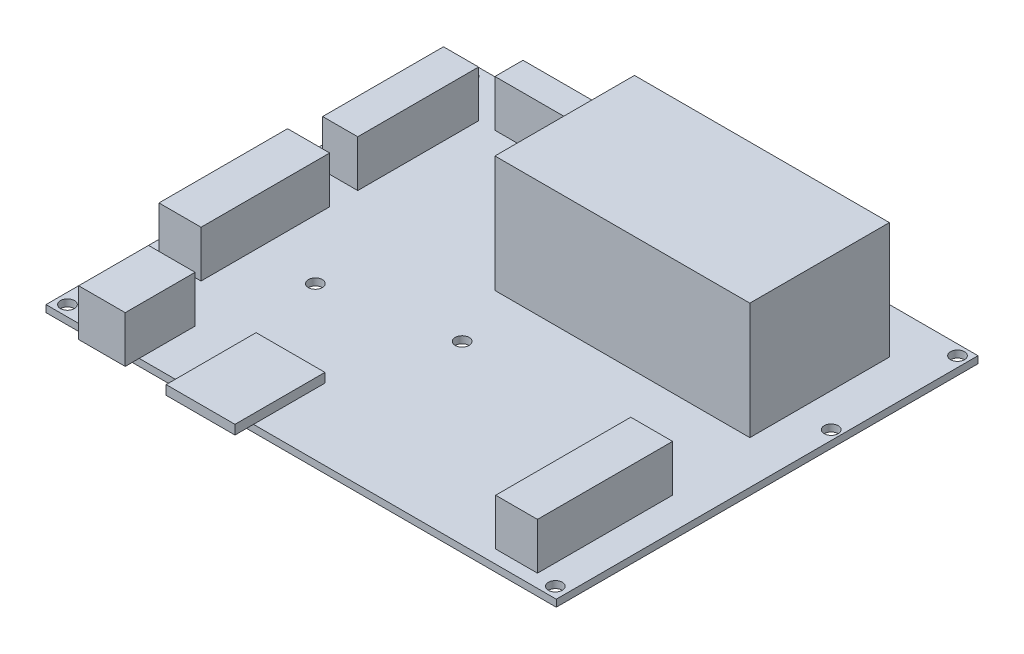
from build123d import *

# Parameters (mm, degrees)
SKETCH1_W           = 109.5
SKETCH1_H           = 90.5
SKETCH1_R           = 1.5
BOSS_EXTRUDE1_DEPTH = 1.5
SKETCH2_W           = 10
SKETCH2_H           = 15
BOSS_EXTRUDE2_DEPTH = 10
SKETCH3_W           = 14.7696301
SKETCH3_H           = 19.309368961
BOSS_EXTRUDE3_DEPTH = 2
SKETCH4_W           = 54.699442022
SKETCH4_H           = 29.942508018
BOSS_EXTRUDE4_DEPTH = 25
SKETCH5_W           = 9.03293538
SKETCH5_H           = 27.600635882
SKETCH5_W_2         = 7.52744615
SKETCH5_H_2         = 25.927870071
SKETCH5_W_3         = 22.080508706
SKETCH5_H_3         = 6.02195692
SKETCH5_W_4         = 8.97656987
SKETCH5_H_4         = 28.994339973
BOSS_EXTRUDE5_DEPTH = 10


with BuildPart() as part:
    # Sketch1 → Boss-Extrude1 (new body)
    with BuildSketch(Plane(origin=(0, 0, 0), x_dir=(1, 0, 0), z_dir=(0, 1, 0))):
        Rectangle(SKETCH1_W, SKETCH1_H)
        with Locations(Location((-52.45, -42.95, 0), (0, 0, 270))):
            Circle(SKETCH1_R, mode=Mode.SUBTRACT)
        with Locations(Location((-29.75, -12.45, 0), (0, 0, 270))):
            Circle(SKETCH1_R, mode=Mode.SUBTRACT)
        with Locations(Location((52.25, -42.95, 0), (0, 0, 270))):
            Circle(SKETCH1_R, mode=Mode.SUBTRACT)
        with Locations(Location((52.55, 43.05, 0), (0, 0, 270))):
            Circle(SKETCH1_R, mode=Mode.SUBTRACT)
        with Locations(Location((-51.75, 42.55, 0), (0, 0, 270))):
            Circle(SKETCH1_R, mode=Mode.SUBTRACT)
        with Locations(Location((-3.25, -7.45, 0), (0, 0, 270))):
            Circle(SKETCH1_R, mode=Mode.SUBTRACT)
        with Locations(Location((52.75, 15.75, 0), (0, 0, 270))):
            Circle(SKETCH1_R, mode=Mode.SUBTRACT)
    extrude(amount=BOSS_EXTRUDE1_DEPTH)

    # Sketch2 → Boss-Extrude2 (add)
    with BuildSketch(Plane(origin=(0, 1.5, 0), x_dir=(1, 0, 0), z_dir=(0, 1, 0))):
        with Locations((-39.75, -40.75)):
            Rectangle(SKETCH2_W, SKETCH2_H)
    extrude(amount=BOSS_EXTRUDE2_DEPTH)

    # Sketch3 → Boss-Extrude3 (add)
    with BuildSketch(Plane(origin=(0, 1.5, 0), x_dir=(1, 0, 0), z_dir=(0, 1, 0))):
        with Locations((-17.607300973, -39.57462345)):
            Rectangle(SKETCH3_W, SKETCH3_H)
    extrude(amount=BOSS_EXTRUDE3_DEPTH)

    # Sketch4 → Boss-Extrude4 (add)
    with BuildSketch(Plane(origin=(0, 1.5, 0), x_dir=(1, 0, 0), z_dir=(0, 1, 0))):
        with Locations((18.14950905, 20.509046194)):
            Rectangle(SKETCH4_W, SKETCH4_H)
    extrude(amount=BOSS_EXTRUDE4_DEPTH)

    # Sketch5 → Boss-Extrude5 (add)
    with BuildSketch(Plane(origin=(0, 1.5, 0), x_dir=(1, 0, 0), z_dir=(0, 1, 0))):
        with Locations((-47.004719291, -10.437121311)):
            Rectangle(SKETCH5_W, SKETCH5_H)
        with Locations((-46.251974676, 22.349088585)):
            Rectangle(SKETCH5_W_2, SKETCH5_H_2)
        with Locations((-27.935189045, 38.324002081)):
            Rectangle(SKETCH5_W_3, SKETCH5_H_3)
        with Locations((43.413693804, -27.937937952)):
            Rectangle(SKETCH5_W_4, SKETCH5_H_4)
    extrude(amount=BOSS_EXTRUDE5_DEPTH)


solid = part.part
